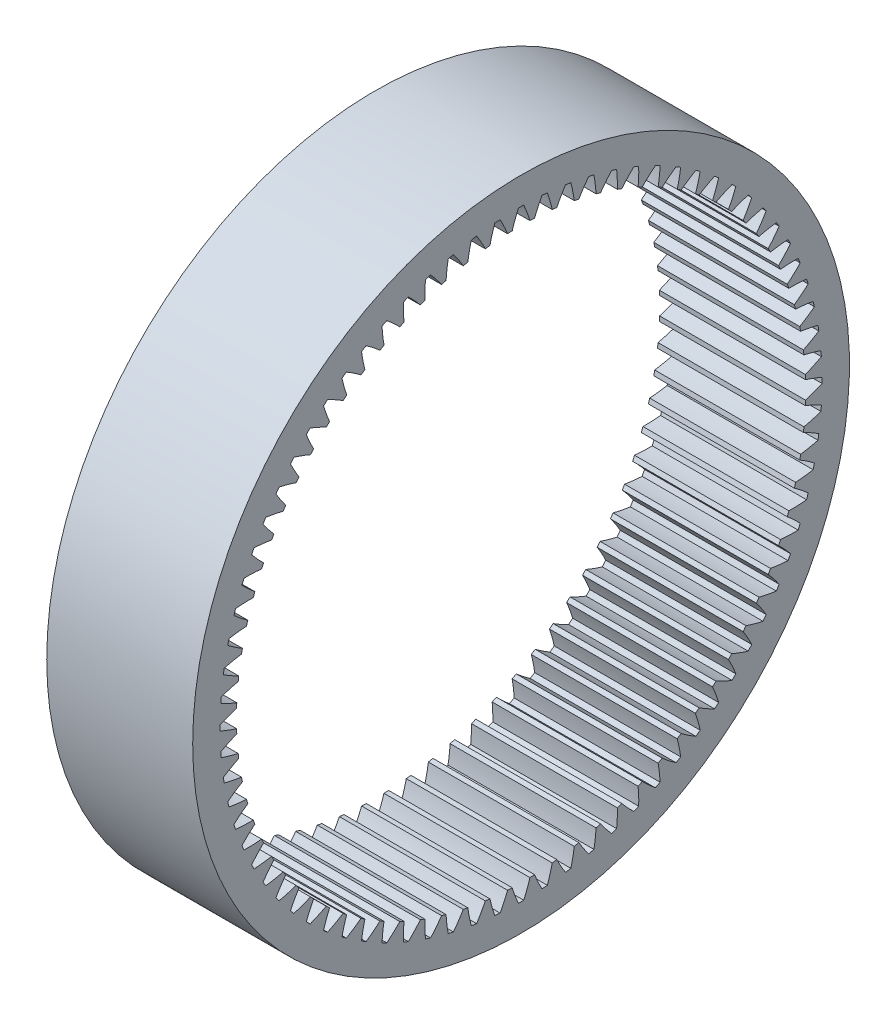
from build123d import *

# Parameters (mm, degrees)
BASPROSKE_W     = 30
BASPROSKE_H     = 9
TOOTHCUT_DEPTH  = 101.062480481
TEETHCUTS_COUNT = 80
TEETHCUTS_ANGLE = 355.5
SKETCH_1_R      = 1.666044899
EXTRUDE_2_DEPTH = 30


with BuildPart() as part:
    # BasProSke → Base-Revolve (revolve)
    with BuildSketch(Plane(origin=(0, 0, 0), x_dir=(1, 0, 0), z_dir=(0, 1, 0)), mode=Mode.PRIVATE) as base_revolve_sk:
        with Locations((15, 63)):
            Rectangle(BASPROSKE_W, BASPROSKE_H)
    revolve(base_revolve_sk.sketch.rotate(Axis((-10, 0, 0), (1, 0, 0)), 180), axis=Axis((-10, 0, 0), (1, 0, 0)))

    # TooCutSke → ToothCut (cut, through all)
    with BuildSketch(Plane(origin=(0, 0, 0), x_dir=(0, 0, -1), z_dir=(1, 0, 0))):
        with BuildLine():
            ThreePointArc((1.824072261, 58.446142777), (1.239315499, 60.179278031), (0.550024051, 61.873555333))
            ThreePointArc((0.550024051, 61.873555333), (0, 61.876), (-0.550024051, 61.873555333))
            ThreePointArc((-0.550024051, 61.873555333), (-1.239315499, 60.179278031), (-1.824072261, 58.446142777))
            ThreePointArc((-1.824072261, 58.446142777), (0, 58.4746), (1.824072261, 58.446142777))
        make_face()
    toothcut = extrude(amount=TOOTHCUT_DEPTH, mode=Mode.SUBTRACT)

    # TeethCuts: ToothCut ×80 about axis
    teethcuts_axis = Axis((-10, 0, 0), (1, 0, 0))
    for i in range(1, TEETHCUTS_COUNT):
        add(toothcut.rotate(teethcuts_axis, i * TEETHCUTS_ANGLE / (TEETHCUTS_COUNT - 1)), mode=Mode.SUBTRACT)

    # Эскиз1 → Бобышка-Вытянуть2 (add)
    with BuildSketch(Plane(origin=(30, 0, 0), x_dir=(0, 0, -1), z_dir=(1, 0, 0))):
        with Locations((-53.617314489, 36.209958452)):
            Circle(SKETCH_1_R)
    extrude(amount=-EXTRUDE_2_DEPTH)


solid = part.part
